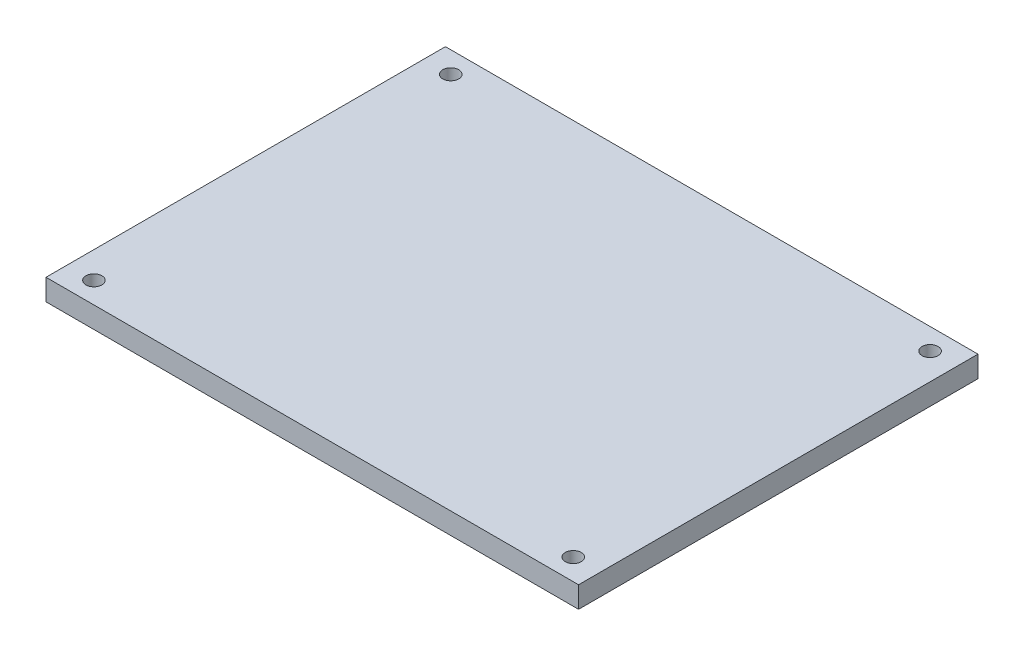
from build123d import *

# Parameters (mm, degrees)
SKETCH1_W           = 100
SKETCH1_H           = 75
SKETCH1_R           = 1.5
BOSS_EXTRUDE1_DEPTH = 4


with BuildPart() as part:
    # Sketch1 → Boss-Extrude1 (new body)
    with BuildSketch(Plane(origin=(0, 0, 0), x_dir=(1, 0, 0), z_dir=(0, 1, 0))):
        Rectangle(SKETCH1_W, SKETCH1_H)
        with Locations(Location((-45, 33.5, 0), (0, 0, 270))):
            Circle(SKETCH1_R, mode=Mode.SUBTRACT)
        with Locations(Location((-45, -33.5, 0), (0, 0, 270))):
            Circle(SKETCH1_R, mode=Mode.SUBTRACT)
        with Locations(Location((45, 33.5, 0), (0, 0, 270))):
            Circle(SKETCH1_R, mode=Mode.SUBTRACT)
        with Locations(Location((45, -33.5, 0), (0, 0, 270))):
            Circle(SKETCH1_R, mode=Mode.SUBTRACT)
    extrude(amount=BOSS_EXTRUDE1_DEPTH)


solid = part.part
